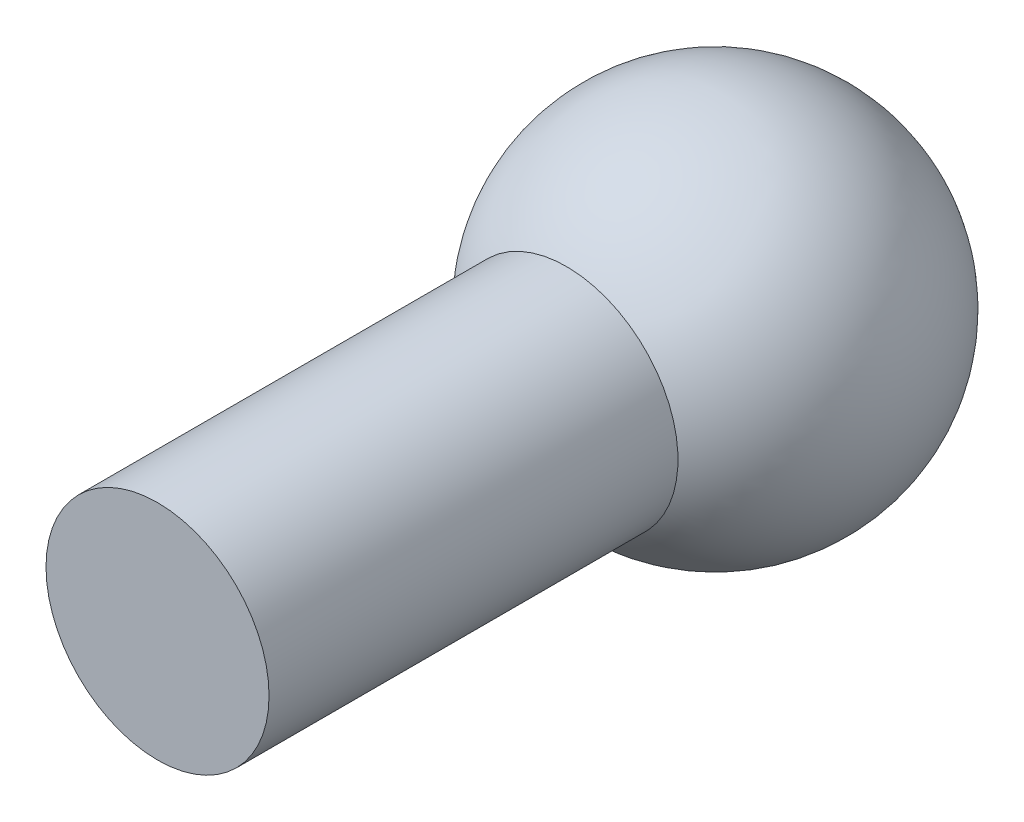
from build123d import *

# Parameters (mm, degrees)
SKETCH_2_R      = 3
EXTRUDE_1_DEPTH = 15


with BuildPart() as part:
    # 草图1 → 旋转1 (revolve)
    with BuildSketch(Plane.XY):
        with BuildLine():
            Line((0, -5), (0, 5))
            ThreePointArc((0, 5), (-5, 0), (0, -5))
        make_face()
    revolve(axis=Axis((0, -1000, 0), (0, 1, 0)))

    # 草图2 → 拉伸1 (add)
    with BuildSketch(Plane.XY):
        with Locations(Location((0, 0, 0), (0, 0, 180))):
            Circle(SKETCH_2_R)
    extrude(amount=EXTRUDE_1_DEPTH)


solid = part.part
